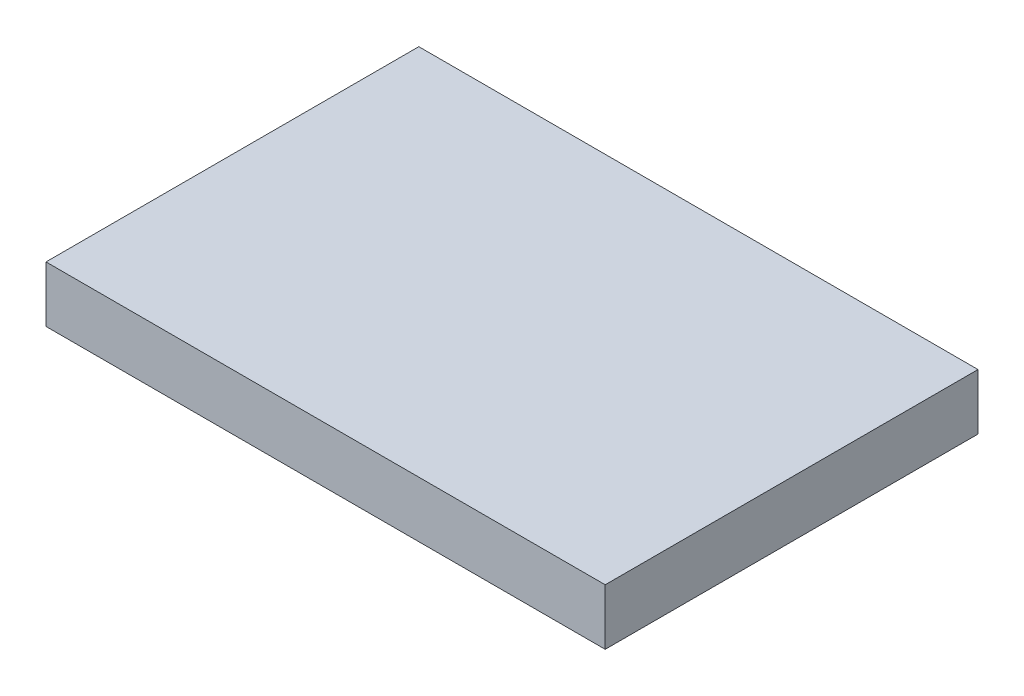
from build123d import *

# Parameters (mm, degrees)
SKETCH1_W           = 300
SKETCH1_H           = 200
BOSS_EXTRUDE1_DEPTH = 30


with BuildPart() as part:
    # Sketch1 → Boss-Extrude1 (new body)
    with BuildSketch(Plane(origin=(0, 0, 0), x_dir=(1, 0, 0), z_dir=(0, 1, 0))):
        with Locations((-100, 0)):
            Rectangle(SKETCH1_W, SKETCH1_H)
    extrude(amount=BOSS_EXTRUDE1_DEPTH)


solid = part.part
